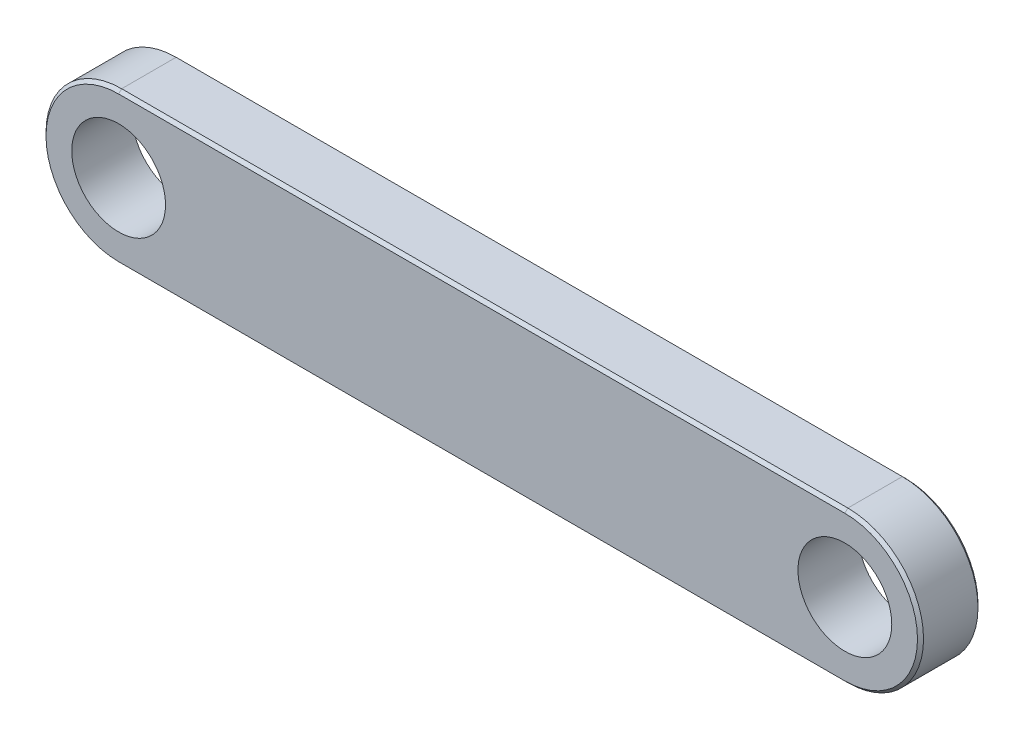
from build123d import *

# Parameters (mm, degrees)
SKETCH1_R           = 1.55
BOSS_EXTRUDE1_DEPTH = 2
CHAMFER1_SIZE       = 0.1


with BuildPart() as part:
    # Sketch1 → Boss-Extrude1 (new body)
    with BuildSketch(Plane.XY):
        with BuildLine():
            Line((-12, 2.5), (12, 2.5))
            ThreePointArc((12, 2.5), (14.5, 0), (12, -2.5))
            Line((12, -2.5), (-12, -2.5))
            ThreePointArc((-12, -2.5), (-14.5, 0), (-12, 2.5))
        make_face()
        with Locations((-12, 0)):
            Circle(SKETCH1_R, mode=Mode.SUBTRACT)
        with Locations((12, 0)):
            Circle(SKETCH1_R, mode=Mode.SUBTRACT)
    extrude(amount=BOSS_EXTRUDE1_DEPTH)

    # Chamfer1
    chamfer1_edges = [part.edges().sort_by_distance(p)[0] for p in [
        (14.5, 0, 2),
        (0, 2.5, 2),
        (-14.5, 0, 2),
        (0, 2.5, 0),
        (14.5, 0, 0),
        (0, -2.5, 0),
        (-14.5, 0, 0),
        (0, -2.5, 2),
    ]]
    chamfer(chamfer1_edges, length=CHAMFER1_SIZE)


solid = part.part
